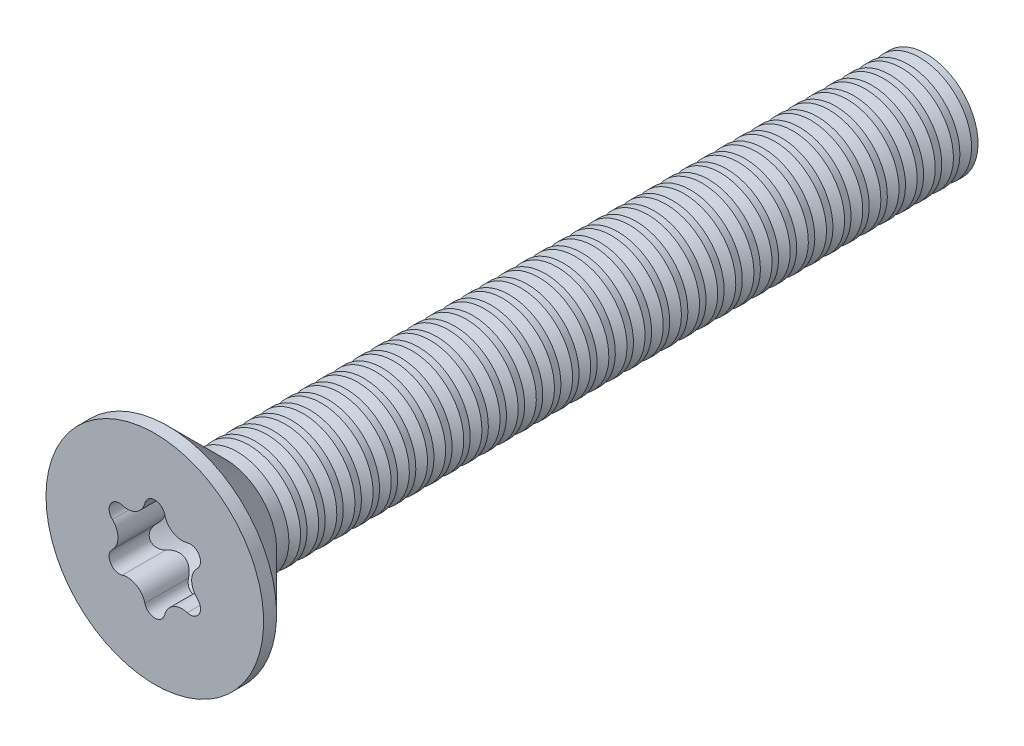
from build123d import *

# Parameters (mm, degrees)
HEXALOBULAR_REACH = 32.582
THDSCHPAT_COUNT   = 39
THDSCHPAT_PITCH   = 0.7


with BuildPart() as part:
    # BodySke → Base-Revolve (revolve)
    with BuildSketch(Plane(origin=(0, 0, 0), x_dir=(0, 0, -1), z_dir=(1, 0, 0)), mode=Mode.PRIVATE) as base_revolve_sk:
        Polygon((0, 0), (0, 4.2), (0.5, 4.2), (2.7, 2), (30, 2), (30, 0), align=None)
    revolve(base_revolve_sk.sketch.rotate(Axis((0, 0, 0), (0, 0, 1)), 90), axis=Axis((0, 0, 0), (0, 0, 1)))

    # PreBSke → PreBroach (revolve, cut)
    with BuildSketch(Plane(origin=(0, 0, 0), x_dir=(0, 0, -1), z_dir=(1, 0, 0)), mode=Mode.PRIVATE) as prebroach_sk:
        Polygon((0, 0), (0, 1.975), (1.53, 1.975), (2.716699723, 0), align=None)
    revolve(prebroach_sk.sketch.rotate(Axis((0, 0, 0), (0, 0, 1)), 90), axis=Axis((0, 0, 0), (0, 0, 1)), mode=Mode.SUBTRACT)

    # Hexalobular: up to this cone (the profile starts inside it)
    hexalobular_end = Plane(origin=(0, 0, 0), z_dir=(0, 0, 1)).offset(-2.716698723) * Cone(1.664e-06, 67.1038275, 40.320046331, align=(Align.CENTER, Align.CENTER, Align.MIN), mode=Mode.PRIVATE)
    # HexSke → Hexalobular (add, up to the surface)
    with BuildSketch(Plane.XY, mode=Mode.PRIVATE) as hexalobular_sk1:
        with BuildLine():
            ThreePointArc((-1.710400172, -0.9875), (-1.759153793, -0.73278065), (-1.639427829, -0.502727273))
            ThreePointArc((-1.639427829, -0.502727273), (-1.422616288, 0), (-1.639427829, 0.502727273))
            ThreePointArc((-1.639427829, 0.502727273), (-1.759153793, 0.73278065), (-1.710400172, 0.9875))
            ThreePointArc((-1.710400172, 0.9875), (-1.975, 0), (-1.710400172, -0.9875))
        make_face()
    hexalobular_tool1 = extrude(hexalobular_sk1.sketch, amount=-HEXALOBULAR_REACH, mode=Mode.PRIVATE) & hexalobular_end
    add(hexalobular_tool1.solids().sort_by_distance((-1.729243, 0, 0))[0])
    # HexSke → Hexalobular (add, up to the surface)
    with BuildSketch(Plane.XY, mode=Mode.PRIVATE) as hexalobular_sk2:
        with BuildLine():
            ThreePointArc((0, 1.975), (-0.9875, 1.710400172), (-1.710400172, 0.9875))
            ThreePointArc((-1.710400172, 0.9875), (-1.514183555, 1.157081549), (-1.255088504, 1.168422511))
            ThreePointArc((-1.255088504, 1.168422511), (-0.711308144, 1.232021846), (-0.384339325, 1.671149784))
            ThreePointArc((-0.384339325, 1.671149784), (-0.244970238, 1.889862199), (0, 1.975))
        make_face()
    hexalobular_tool2 = extrude(hexalobular_sk2.sketch, amount=-HEXALOBULAR_REACH, mode=Mode.PRIVATE) & hexalobular_end
    add(hexalobular_tool2.solids().sort_by_distance((-0.864621, 1.497568, 0))[0])
    # HexSke → Hexalobular (add, up to the surface)
    with BuildSketch(Plane.XY, mode=Mode.PRIVATE) as hexalobular_sk3:
        with BuildLine():
            ThreePointArc((1.710400172, 0.9875), (0.9875, 1.710400172), (0, 1.975))
            ThreePointArc((0, 1.975), (0.244970238, 1.889862199), (0.384339325, 1.671149784))
            ThreePointArc((0.384339325, 1.671149784), (0.711308144, 1.232021846), (1.255088504, 1.168422511))
            ThreePointArc((1.255088504, 1.168422511), (1.514183555, 1.157081549), (1.710400172, 0.9875))
        make_face()
    hexalobular_tool3 = extrude(hexalobular_sk3.sketch, amount=-HEXALOBULAR_REACH, mode=Mode.PRIVATE) & hexalobular_end
    add(hexalobular_tool3.solids().sort_by_distance((0.864621, 1.497568, 0))[0])
    # HexSke → Hexalobular (add, up to the surface)
    with BuildSketch(Plane.XY, mode=Mode.PRIVATE) as hexalobular_sk4:
        with BuildLine():
            ThreePointArc((1.639427829, -0.502727273), (1.759153793, -0.73278065), (1.710400172, -0.9875))
            ThreePointArc((1.710400172, -0.9875), (1.907703507, -0.511167614), (1.975, 0))
            ThreePointArc((1.975, 0), (1.907703507, 0.511167614), (1.710400172, 0.9875))
            ThreePointArc((1.710400172, 0.9875), (1.759153793, 0.73278065), (1.639427829, 0.502727273))
            ThreePointArc((1.639427829, 0.502727273), (1.422616288, 0), (1.639427829, -0.502727273))
        make_face()
    hexalobular_tool4 = extrude(hexalobular_sk4.sketch, amount=-HEXALOBULAR_REACH, mode=Mode.PRIVATE) & hexalobular_end
    add(hexalobular_tool4.solids().sort_by_distance((1.729243, 0, 0))[0])
    # HexSke → Hexalobular (add, up to the surface)
    with BuildSketch(Plane.XY, mode=Mode.PRIVATE) as hexalobular_sk5:
        with BuildLine():
            ThreePointArc((0.384339325, -1.671149784), (0.244970238, -1.889862199), (0, -1.975))
            ThreePointArc((0, -1.975), (0.9875, -1.710400172), (1.710400172, -0.9875))
            ThreePointArc((1.710400172, -0.9875), (1.514183555, -1.157081549), (1.255088504, -1.168422511))
            ThreePointArc((1.255088504, -1.168422511), (0.711308144, -1.232021846), (0.384339325, -1.671149784))
        make_face()
    hexalobular_tool5 = extrude(hexalobular_sk5.sketch, amount=-HEXALOBULAR_REACH, mode=Mode.PRIVATE) & hexalobular_end
    add(hexalobular_tool5.solids().sort_by_distance((0.864621, -1.497568, 0))[0])
    # HexSke → Hexalobular (add, up to the surface)
    with BuildSketch(Plane.XY, mode=Mode.PRIVATE) as hexalobular_sk6:
        with BuildLine():
            ThreePointArc((-1.255088504, -1.168422511), (-1.514183555, -1.157081549), (-1.710400172, -0.9875))
            ThreePointArc((-1.710400172, -0.9875), (-0.9875, -1.710400172), (0, -1.975))
            ThreePointArc((0, -1.975), (-0.244970238, -1.889862199), (-0.384339325, -1.671149784))
            ThreePointArc((-0.384339325, -1.671149784), (-0.711308144, -1.232021846), (-1.255088504, -1.168422511))
        make_face()
    hexalobular_tool6 = extrude(hexalobular_sk6.sketch, amount=-HEXALOBULAR_REACH, mode=Mode.PRIVATE) & hexalobular_end
    add(hexalobular_tool6.solids().sort_by_distance((-0.864621, -1.497568, 0))[0])

    # ThdSchSke → ThreadSchematic (revolve, cut)
    with BuildSketch(Plane(origin=(0, 0, 0), x_dir=(0, 0, -1), z_dir=(1, 0, 0))):
        Polygon((30.225166605, 2), (30, 1.61), (29.774833395, 2), align=None)
    threadschematic = revolve(axis=Axis((0, 0, 0), (0, 0, 1)), mode=Mode.SUBTRACT)

    # ThdSchPat: ThreadSchematic ×39
    with Locations(*[(0, 0, i * THDSCHPAT_PITCH) for i in range(1, THDSCHPAT_COUNT)]):
        add(threadschematic, mode=Mode.SUBTRACT)


solid = part.part
